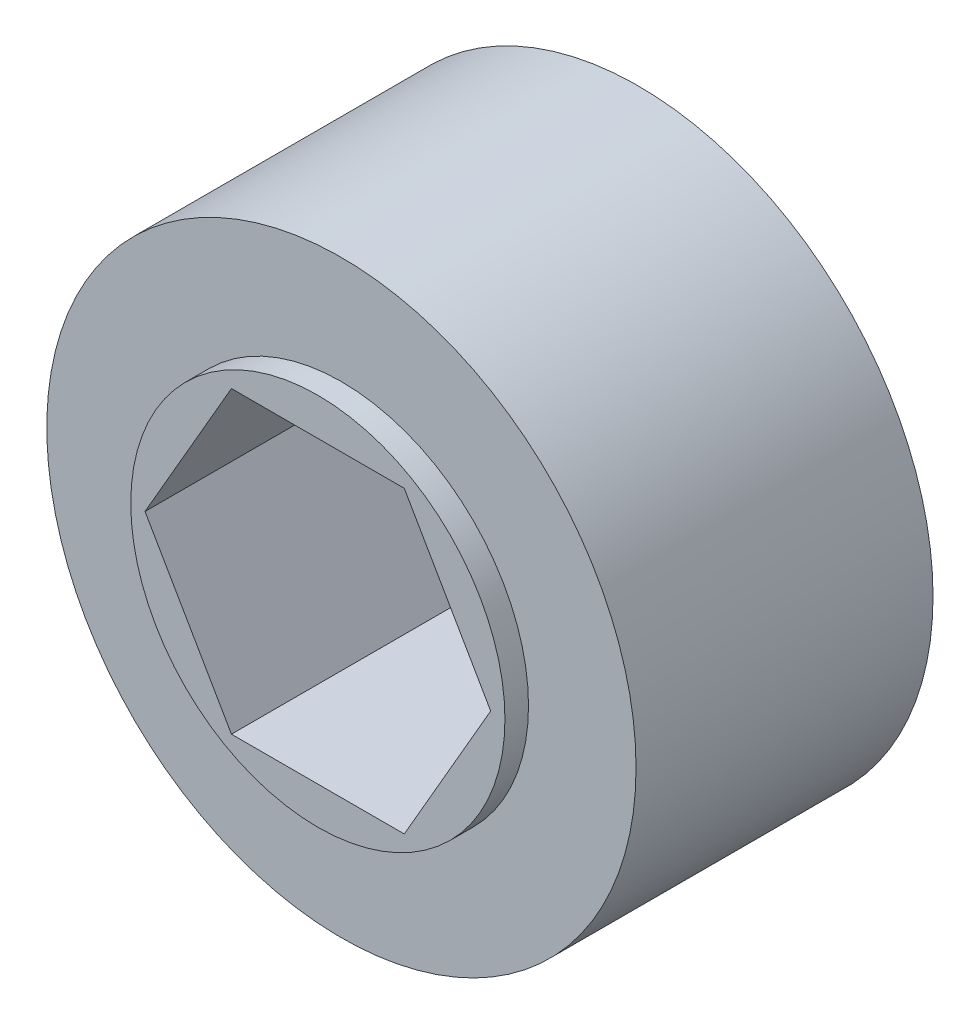
from build123d import *

# Parameters (mm, degrees)
SKETCH1_R           = 12.5
BOSS_EXTRUDE1_DEPTH = 6.8
SKETCH2_R           = 12.5
SKETCH2_R_2         = 7.9375
CUT_EXTRUDE1_DEPTH  = 1


with BuildPart() as part:
    # Sketch1 → Boss-Extrude1 (new, symmetric)
    with BuildSketch(Plane.XY):
        Circle(SKETCH1_R)
        Polygon((7.332348419, 0), (3.666174209, 6.35), (-3.666174209, 6.35), (-7.332348419, 0), (-3.666174209, -6.35), (3.666174209, -6.35), align=None, mode=Mode.SUBTRACT)
    extrude(amount=BOSS_EXTRUDE1_DEPTH, both=True)

    # Sketch2 → Cut-Extrude1 (cut)
    with BuildSketch(Plane.XY.offset(6.8)):
        Circle(SKETCH2_R)
        Circle(SKETCH2_R_2, mode=Mode.SUBTRACT)
    extrude(amount=-CUT_EXTRUDE1_DEPTH, mode=Mode.SUBTRACT)


solid = part.part
